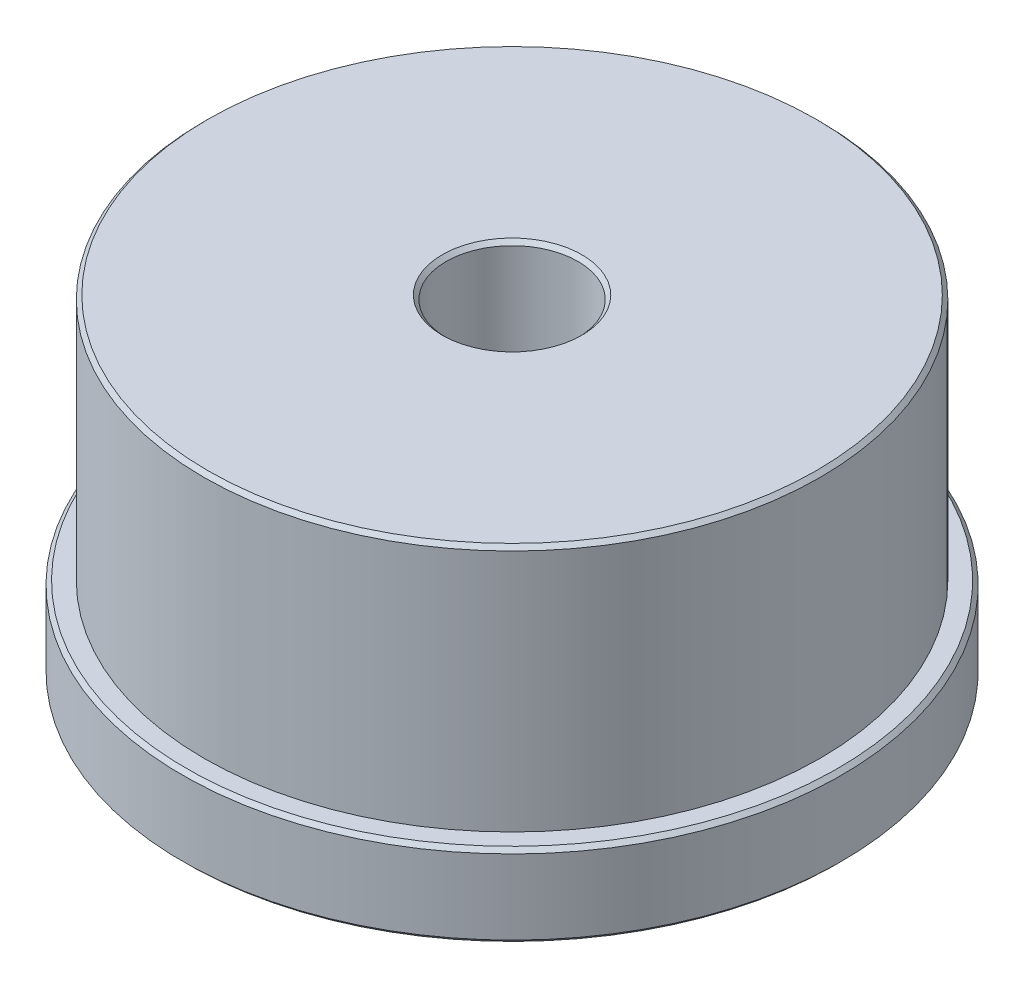
from build123d import *

# Parameters (mm, degrees)
SKETCH1_R           = 23.749
BOSS_EXTRUDE1_DEPTH = 19.05
SKETCH2_R           = 25.4
BOSS_EXTRUDE2_DEPTH = 6.35
SKETCH3_R           = 5.08
CUT_EXTRUDE1_DEPTH  = 44.994090512
SKETCH4_R           = 11.1125
CUT_EXTRUDE2_DEPTH  = 5.5372
CHAMFER1_SIZE       = 0.299999908


with BuildPart() as part:
    # Sketch1 → Boss-Extrude1 (new body)
    with BuildSketch(Plane(origin=(0, 0, 0), x_dir=(1, 0, 0), z_dir=(0, 1, 0))):
        with Locations(Location((0, 0, 0), (0, 0, 90))):
            Circle(SKETCH1_R)
    extrude(amount=BOSS_EXTRUDE1_DEPTH)

    # Sketch2 → Boss-Extrude2 (add)
    with BuildSketch(Plane.XZ):
        with Locations(Location((0, 0, 0), (0, 0, 270))):
            Circle(SKETCH2_R)
    extrude(amount=BOSS_EXTRUDE2_DEPTH)

    # Sketch3 → Cut-Extrude1 (cut, through all)
    with BuildSketch(Plane.XZ.offset(6.35)):
        with Locations(Location((0, 0, 0), (0, 0, 270))):
            Circle(SKETCH3_R)
    extrude(amount=-CUT_EXTRUDE1_DEPTH, mode=Mode.SUBTRACT)

    # Sketch4 → Cut-Extrude2 (cut)
    with BuildSketch(Plane.XZ.offset(6.35)):
        with Locations(Location((0, 0, 0), (0, 0, 270))):
            Circle(SKETCH4_R)
    extrude(amount=-CUT_EXTRUDE2_DEPTH, mode=Mode.SUBTRACT)

    # Chamfer1
    chamfer1_edges = [part.edges().sort_by_distance(p)[0] for p in [
        (0, 19.05, 5.08),
        (0, -6.35, 11.1125),
        (0, -0.8128, 5.08),
        (0, 19.05, 23.749),
        (0, 0, 25.4),
        (0, -6.35, 25.4),
    ]]
    chamfer(chamfer1_edges, length=CHAMFER1_SIZE)


solid = part.part
